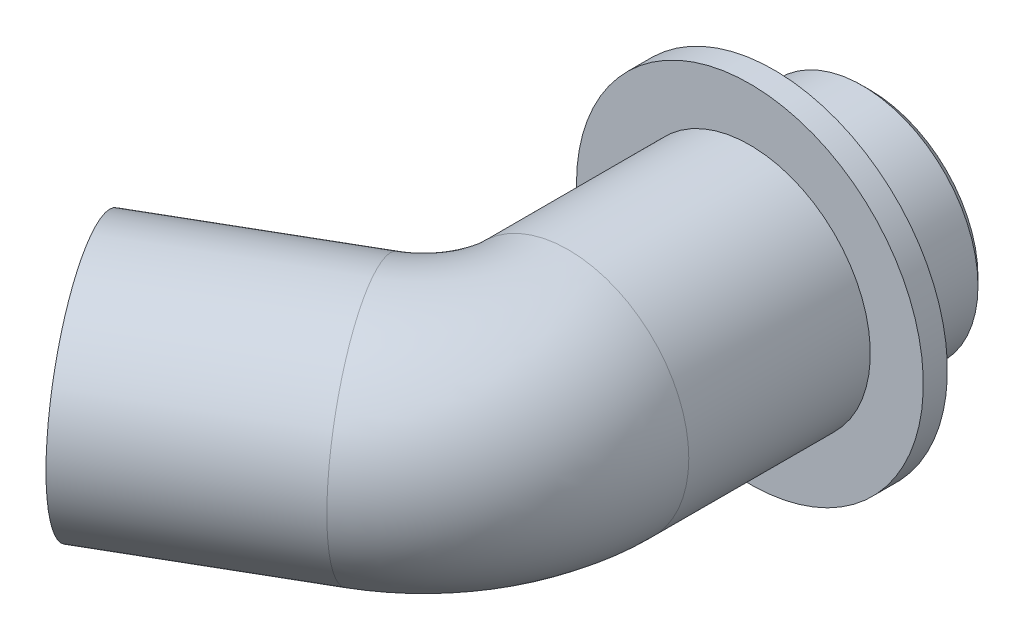
from build123d import *

# Parameters (mm, degrees)
SKETCH_1_R          = 25
SKETCH_1_R_2        = 15
EXTRUDE_START       = -25
SKETCH_3_R          = 36
SKETCH_3_R_2        = 25
EXTRUDE_2_DEPTH     = 5
SKETCH_4_W          = 10
SKETCH_4_H          = 4
CUT_EXTRUDE_1_REACH = 152.941
SKETCH_5_R          = 25
SKETCH_5_R_2        = 24
CHAMFER_1_SIZE      = 1.648


with BuildPart() as part:
    # По траектории1: sweep along a path in Эскиз2
    with BuildLine(Plane(origin=(0, 0, 0), x_dir=(1, 0, 0), z_dir=(0, 1, 0))) as sweep_1_path:
        Line((0, 0), (0, -62.679491924))
        ThreePointArc((0, -62.679491924), (-4.019237886, -77.679491924), (-15, -88.660254038))
        Line((-15, -88.660254038), (-51.961524227, -110))
    # Эскиз1 → По траектории1 (sweep)
    with BuildSketch(Plane.XY):
        Circle(SKETCH_1_R)
        Circle(SKETCH_1_R_2, mode=Mode.SUBTRACT)
    sweep(path=sweep_1_path.line)

    # Эскиз3 → Бобышка-Вытянуть2 (add)
    with BuildSketch(Plane(origin=(0, 0, 0), x_dir=(-1, 0, 0), z_dir=(0, 0, -1)).offset(EXTRUDE_START)):
        Circle(SKETCH_3_R)
        Circle(SKETCH_3_R_2, mode=Mode.SUBTRACT)
    extrude(amount=EXTRUDE_2_DEPTH)

    # Эскиз4 → Вырез-Повернуть1 (revolve, cut)
    with BuildSketch(Plane(origin=(0, 0, 0), x_dir=(1, 0, 0), z_dir=(0, 1, 0)), mode=Mode.PRIVATE) as cut_revolve_1_sk:
        with Locations((27, -18)):
            Rectangle(SKETCH_4_W, SKETCH_4_H)
    revolve(cut_revolve_1_sk.sketch.rotate(Axis((0, 0, 0), (0, 0, 1)), 180), axis=Axis((0, 0, 0), (0, 0, 1)), mode=Mode.SUBTRACT)

    # Эскиз5 → Вырез-Вытянуть1 (cut, up to next)
    with BuildSketch(Plane(origin=(0, 0, 0), x_dir=(-1, 0, 0), z_dir=(0, 0, -1)), mode=Mode.PRIVATE) as cut_extrude_1_sk1:
        Circle(SKETCH_5_R)
        Circle(SKETCH_5_R_2, mode=Mode.SUBTRACT)
    cut_extrude_1_tool1 = extrude(cut_extrude_1_sk1.sketch, amount=-CUT_EXTRUDE_1_REACH, mode=Mode.PRIVATE) & part.part
    add(cut_extrude_1_tool1.solids().sort_by_distance((24.292893, 0, 0))[0], mode=Mode.SUBTRACT)

    # Фаска1
    chamfer_1_edges = [part.edges().sort_by_distance(p)[0] for p in [
        (24, 0, 0),
    ]]
    chamfer(chamfer_1_edges, length=CHAMFER_1_SIZE)


solid = part.part
